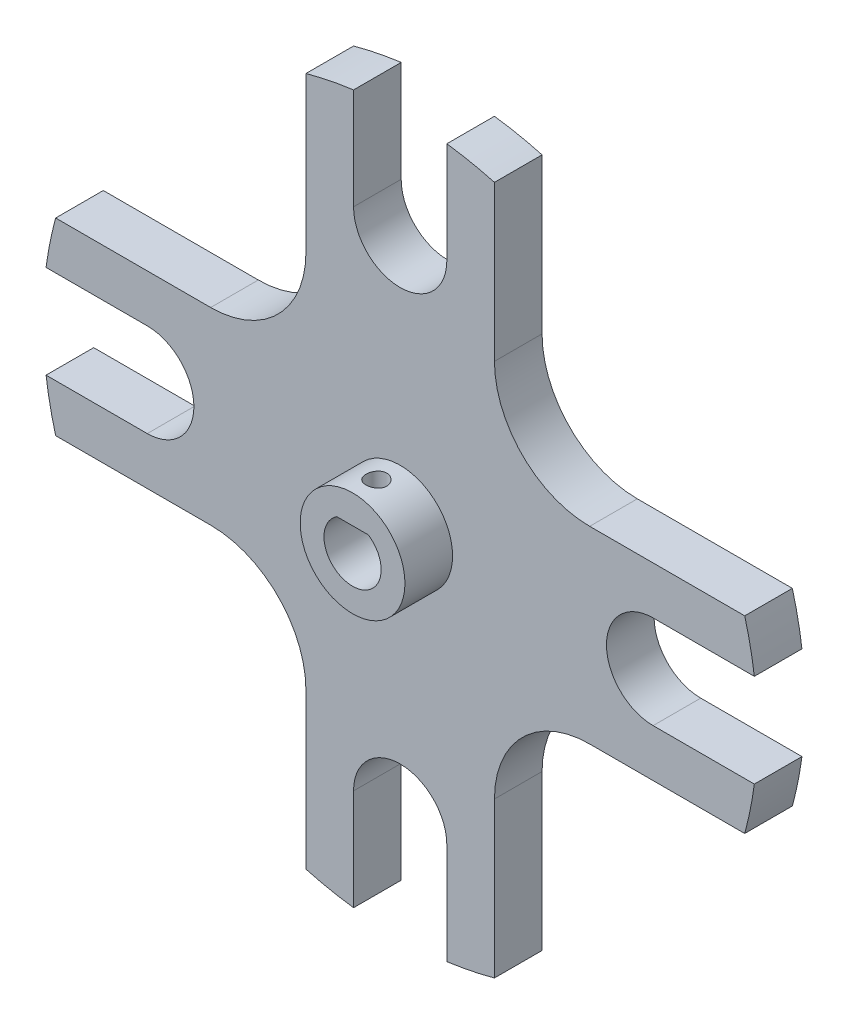
from build123d import *

# Parameters (mm, degrees)
ESQUISSE1_R                  = 75
BOSS_EXTRU_1_DEPTH           = 5
ENL_V_MAT_EXTRU_1_DEPTH      = 20
R_P_TITION_CIRCULAIRE1_COUNT = 4
ESQUISSE3_W                  = 52.549672888
ESQUISSE3_H                  = 52.549672888
ENL_V_MAT_EXTRU_2_DEPTH      = 20
R_P_TITION_CIRCULAIRE2_COUNT = 4
CONG_1_R                     = 20
ENL_V_MAT_EXTRU_3_DEPTH      = 106.632580986
ENL_V_MAT_EXTRU_3_DEPTH_BACK = 106.632580986
ESQUISSE6_R                  = 11
BOSS_EXTRU_2_DEPTH           = 10
ESQUISSE7_R                  = 2.175
ENL_V_MAT_EXTRU_4_DEPTH      = 14


with BuildPart() as part:
    # Esquisse1 → Boss.-Extru.1 (new, symmetric)
    with BuildSketch(Plane.XY):
        Circle(ESQUISSE1_R)
    extrude(amount=BOSS_EXTRU_1_DEPTH, both=True)

    # Esquisse2 → Enlèv. mat.-Extru.1 (cut)
    with BuildSketch(Plane.XY.offset(5)):
        with BuildLine():
            Line((-53.106036975, 9.791778038), (-74.358059972, 9.791778038))
            ThreePointArc((-74.358059972, 9.791778038), (-75, 0), (-74.358059972, -9.791778038))
            Line((-74.358059972, -9.791778038), (-53.106036975, -9.791778038))
            ThreePointArc((-53.106036975, -9.791778038), (-43.314258937, 0), (-53.106036975, 9.791778038))
        make_face()
    enl_v_mat_extru_1 = extrude(amount=-ENL_V_MAT_EXTRU_1_DEPTH, mode=Mode.SUBTRACT)

    # Répétition circulaire1: Enlèv. mat.-Extru.1 ×4 about axis
    r_p_tition_circulaire1_axis = Axis((0, 0, 0), (0, 0, 1))
    for i in range(1, R_P_TITION_CIRCULAIRE1_COUNT):
        add(enl_v_mat_extru_1.rotate(r_p_tition_circulaire1_axis, i * 360 / R_P_TITION_CIRCULAIRE1_COUNT), mode=Mode.SUBTRACT)

    # Esquisse3 → Enlèv. mat.-Extru.2 (cut)
    with BuildSketch(Plane.XY.offset(5)):
        with Locations((-46.066614482, 46.066614482)):
            Rectangle(ESQUISSE3_W, ESQUISSE3_H)
    enl_v_mat_extru_2 = extrude(amount=-ENL_V_MAT_EXTRU_2_DEPTH, mode=Mode.SUBTRACT)

    # Répétition circulaire2: Enlèv. mat.-Extru.2 ×4 about axis
    r_p_tition_circulaire2_axis = Axis((0, 0, 0), (0, 0, 1))
    for i in range(1, R_P_TITION_CIRCULAIRE2_COUNT):
        add(enl_v_mat_extru_2.rotate(r_p_tition_circulaire2_axis, i * 360 / R_P_TITION_CIRCULAIRE2_COUNT), mode=Mode.SUBTRACT)

    # Congé1
    cong_1_edges = [part.edges().sort_by_distance(p)[0] for p in [
        (-19.791778038, -19.791778038, 0),
        (19.791778038, -19.791778038, 0),
        (19.791778038, 19.791778038, 0),
        (-19.791778038, 19.791778038, 0),
    ]]
    fillet(cong_1_edges, radius=CONG_1_R)

    # Esquisse4 → Enlèv. mat.-Extru.3 (cut, two sides: drawn at the far end of the back side and taken through both)
    with BuildSketch(Plane.XY.offset(5).offset(-ENL_V_MAT_EXTRU_3_DEPTH_BACK)):
        with BuildLine():
            Line((-3.31662479, 5), (3.31662479, 5))
            ThreePointArc((3.31662479, 5), (0, -6), (-3.31662479, 5))
        make_face()
    extrude(amount=ENL_V_MAT_EXTRU_3_DEPTH + ENL_V_MAT_EXTRU_3_DEPTH_BACK, mode=Mode.SUBTRACT)

    # Esquisse6 → Boss.-Extru.2 (add)
    with BuildSketch(Plane.XY.offset(5)):
        Circle(ESQUISSE6_R)
        with BuildLine():
            Line((-3.31662479, 5), (3.31662479, 5))
            ThreePointArc((3.31662479, 5), (0, -6), (-3.31662479, 5))
        make_face(mode=Mode.SUBTRACT)
    extrude(amount=BOSS_EXTRU_2_DEPTH)

    # Esquisse7 → Enlèv. mat.-Extru.4 (cut)
    with BuildSketch(Plane(origin=(0, 0, 0), x_dir=(1, 0, 0), z_dir=(0, 1, 0))):
        with Locations(Location((0, -10, 0), (0, 0, 90))):
            Circle(ESQUISSE7_R)
    extrude(amount=ENL_V_MAT_EXTRU_4_DEPTH, mode=Mode.SUBTRACT)


solid = part.part
